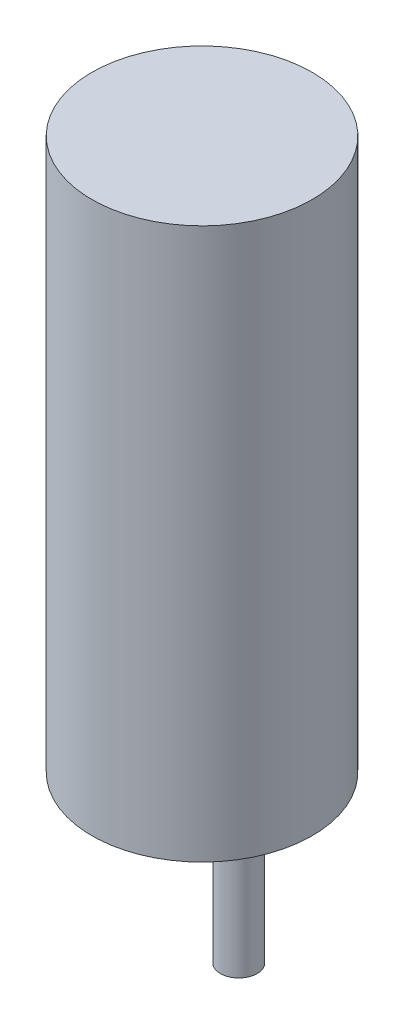
from build123d import *

# Parameters (mm, degrees)
SKETCH1_R           = 18
BOSS_EXTRUDE1_DEPTH = 90
SKETCH2_R           = 3
BOSS_EXTRUDE2_DEPTH = 30


with BuildPart() as part:
    # Sketch1 → Boss-Extrude1 (new body)
    with BuildSketch(Plane(origin=(0, 0, 0), x_dir=(1, 0, 0), z_dir=(0, 1, 0))):
        with Locations(Location((0, 0, 0), (0, 0, 90))):
            Circle(SKETCH1_R)
    extrude(amount=BOSS_EXTRUDE1_DEPTH)

    # Sketch2 → Boss-Extrude2 (add)
    with BuildSketch(Plane.XZ):
        with Locations(Location((0, -6, 0), (0, 0, 90))):
            Circle(SKETCH2_R)
    extrude(amount=BOSS_EXTRUDE2_DEPTH)


solid = part.part
